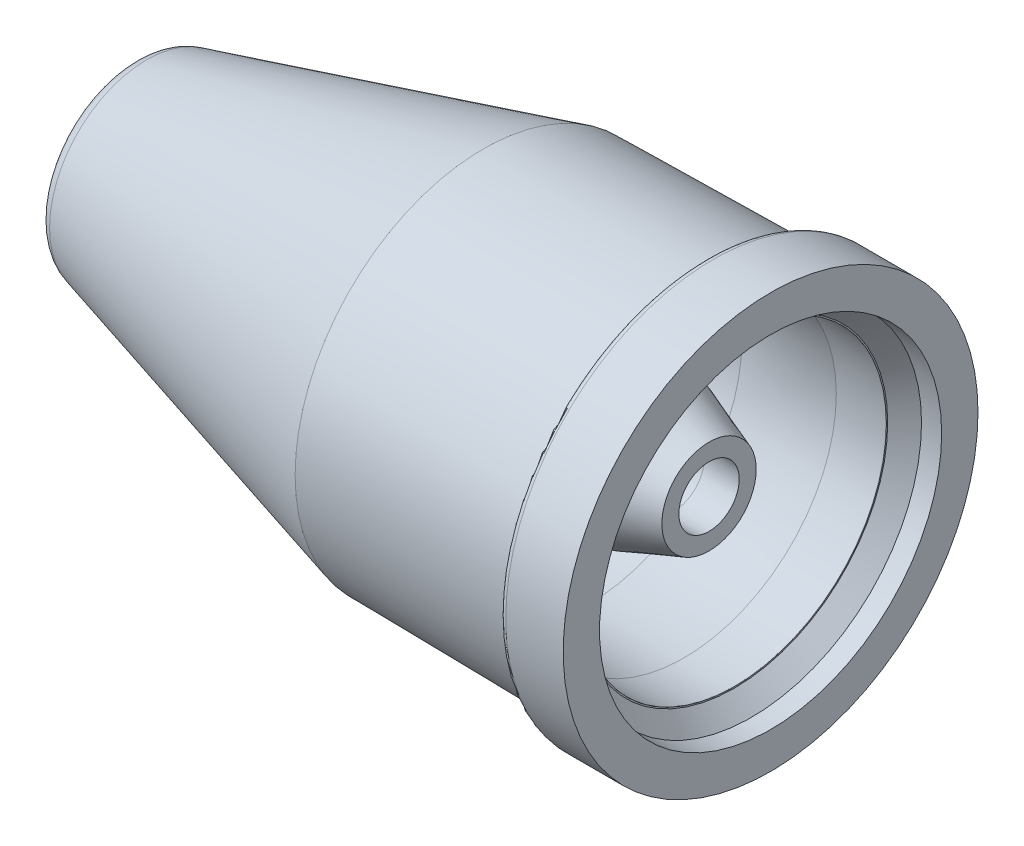
from build123d import *

# Parameters (mm, degrees)
FILLET1_R       = 0.3
FILLET2_R       = 0.1
MOLDE_1_5_SCALE = 1.015
ESCALA1_SCALE   = 0.985


with BuildPart() as part:
    # Sketch1 → Base-Revolve (revolve)
    with BuildSketch(Plane.XY, mode=Mode.PRIVATE) as base_revolve_sk:
        with BuildLine():
            Line((0, 2.680722334), (0, 3.25))
            Line((0, 3.25), (-1, 3.25))
            Line((-1, 3.25), (-1, 3))
            Line((-1, 3), (-4.5, 2.951))
            Line((-4.5, 2.951), (-10, 1.45996726))
            Line((-10, 1.45996726), (-10, 1.182))
            Line((-10, 1.182), (-9.942216749, 1.182))
            Line((-9.942216749, 1.182), (-9.62665493, 1.112320106))
            ThreePointArc((-9.62665493, 1.112320106), (-9.570254637, 1.077297478), (-9.548216749, 1.014672331))
            Line((-9.548216749, 1.014672331), (-9.548216749, 0.911125))
            Line((-9.548216749, 0.911125), (-5.951168635, 0.862068966))
            ThreePointArc((-5.951168635, 0.862068966), (-5.881136472, 0.832413596), (-5.852216749, 0.762074458))
            Line((-5.852216749, 0.762074458), (-5.852216749, 0.492610835))
            Line((-5.852216749, 0.492610835), (-1.527654115, 0.492610835))
            Line((-1.527654115, 0.492610835), (-0.960346026, 0.4728))
            Line((-0.960346026, 0.4728), (-0.960346026, 0.875013102))
            Line((-0.960346026, 0.875013102), (-1.684186294, 1.068965517))
            Line((-1.684186294, 1.068965517), (-5.28, 1.108374384))
            Line((-5.28, 1.108374384), (-5.28, 1.25))
            Line((-5.28, 1.25), (-5.28, 1.475))
            Line((-5.28, 1.475), (-7.53, 1.475))
            Line((-7.53, 1.475), (-7.53, 1.572428375))
            Line((-7.53, 1.572428375), (-6.073686829, 1.976299761))
            ThreePointArc((-6.073686829, 1.976299761), (-5.761104003, 1.959212429), (-5.501968853, 2.134851188))
            Line((-5.501968853, 2.134851188), (-4.81, 2.326751134))
            Line((-4.81, 2.326751134), (-0.565, 2.38))
            Line((-0.565, 2.38), (-0.565, 2.4))
            Line((-0.565, 2.4), (-0.3, 2.665))
            Line((-0.3, 2.665), (0, 2.680722334))
        make_face()
    revolve(base_revolve_sk.sketch.rotate(Axis((3, 0, 0), (-1, 0, 0)), 90), axis=Axis((3, 0, 0), (-1, 0, 0)))

    # Fillet1
    fillet1_edges = [part.edges().sort_by_distance(p)[0] for p in [
        (-10, 0, 1.45996726),
    ]]
    fillet(fillet1_edges, radius=FILLET1_R)

    # Fillet2
    fillet2_edges = [part.edges().sort_by_distance(p)[0] for p in [
        (-1, 0, 3.25),
    ]]
    fillet(fillet2_edges, radius=FILLET2_R)


with BuildPart() as part_1:
    # Molde (1,5%): scaled about (0, 0, 0)
    add(part.part.scale(MOLDE_1_5_SCALE))

    # Esboço1 → Corte-Revolução1 (revolve, cut)
    with BuildSketch(Plane.XY, mode=Mode.PRIVATE) as corte_revolu_o1_sk:
        with BuildLine():
            Line((-0.5792, -2.425), (-0.573475, -0.48))
            Line((-0.573475, -0.48), (-0.9792, -0.48))
            Line((-0.9792, -0.48), (-0.9792, -0.75))
            Line((-0.9792, -0.75), (-1.899604936, -1.085))
            Line((-1.899604936, -1.085), (-5.3592, -1.125))
            Line((-5.3592, -1.125), (-5.3592, -1.5))
            Line((-5.3592, -1.5), (-5.7792, -1.5))
            Line((-5.7792, -1.5), (-5.7792, -2.169796607))
            Line((-5.7792, -2.169796607), (-5.658209357, -2.204490115))
            ThreePointArc((-5.658209357, -2.204490115), (-5.282371308, -2.163571422), (-4.98532617, -2.397436264))
            Line((-4.98532617, -2.397436264), (-4.8892, -2.425))
            Line((-4.8892, -2.425), (-2.879846793, -2.425))
            ThreePointArc((-2.879846793, -2.425), (-2.129846793, -2.375), (-1.379846793, -2.425))
            Line((-1.379846793, -2.425), (-0.5792, -2.425))
        make_face()
    revolve(corte_revolu_o1_sk.sketch.rotate(Axis((0, 0, 0), (-1, 0, 0)), 270), axis=Axis((0, 0, 0), (-1, 0, 0)), mode=Mode.SUBTRACT)


with BuildPart() as body_2:
    # of the pieces the cut leaves, the one that is kept (corte_revolu_o1_keep)
    add(part_1.part.solids().sort_by_distance((-1.015, 0, -3.19725))[0])

    # Esboço2 → Revolução1 (revolve)
    with BuildSketch(Plane.XY, mode=Mode.PRIVATE) as revolu_o1_sk:
        with BuildLine():
            Line((-2.879846793, -2.425), (-2.879846793, -2.544109835))
            Line((-2.879846793, -2.544109835), (-1.379846793, -2.544109835))
            Line((-1.379846793, -2.544109835), (-1.379846793, -2.425))
            ThreePointArc((-1.379846793, -2.425), (-2.129846793, -2.375), (-2.879846793, -2.425))
        make_face()
        with BuildLine():
            Line((-5.7792, -2.169796607), (-5.658209357, -2.204490115))
            ThreePointArc((-5.658209357, -2.204490115), (-5.208810984, -2.191080964), (-4.93032412, -2.544045225))
            Line((-4.93032412, -2.544045225), (-7.873844655, -1.696484939))
            Line((-7.873844655, -1.696484939), (-7.873844655, -1.3516253))
            Line((-7.873844655, -1.3516253), (-5.7792, -1.330608113))
            Line((-5.7792, -1.330608113), (-5.7792, -2.169796607))
        make_face()
    revolve(revolu_o1_sk.sketch.rotate(Axis((-10.72056604, 0, 0), (1, 0, 0)), 90), axis=Axis((-10.72056604, 0, 0), (1, 0, 0)))


with BuildPart() as body_2_1:
    # Escala1: scaled about (-4.651298742, 0, 0)
    add(body_2.part.scale(ESCALA1_SCALE).moved(Location((-0.069769481, 0, 0))))


solid = body_2_1.part
